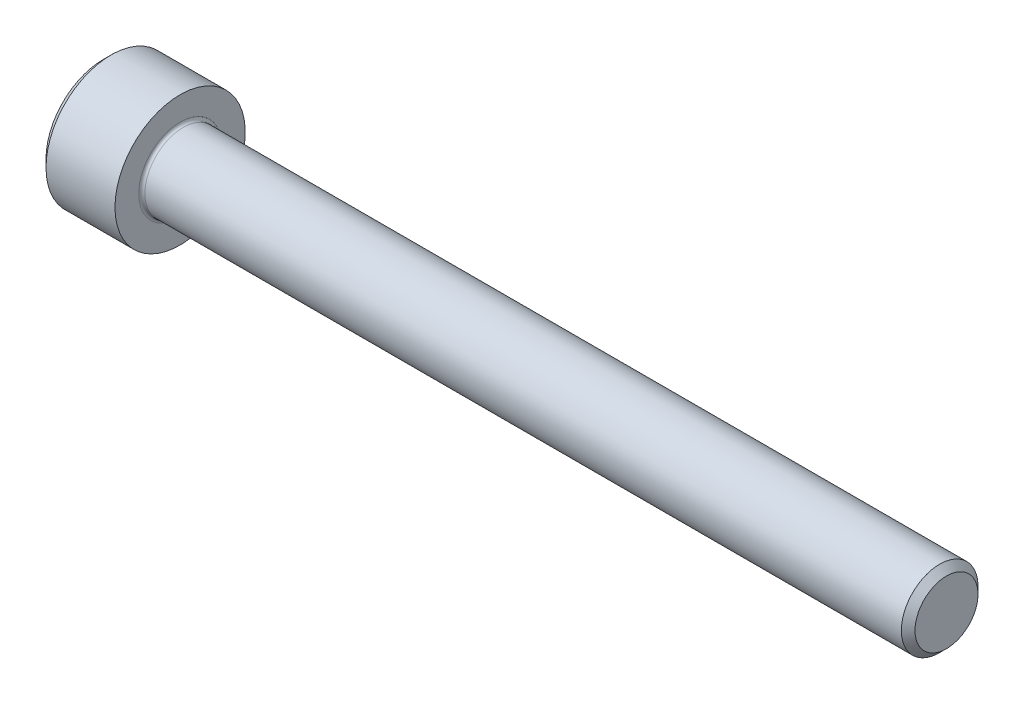
from build123d import *

# Parameters (mm, degrees)
FILLET1_R   = 0.2
HEX_2_DEPTH = 2.5


with BuildPart() as part:
    # BodySke → Base-Revolve (revolve)
    with BuildSketch(Plane.XY, mode=Mode.PRIVATE) as base_revolve_sk:
        Polygon((0, 0), (0, 3.75), (0.5, 4.25), (5, 4.25), (5, 2.5), (54.555, 2.5), (55, 2.055), (55, 0), align=None)
    revolve(base_revolve_sk.sketch.rotate(Axis((-31.75, 0, 0), (1, 0, 0)), 90), axis=Axis((-31.75, 0, 0), (1, 0, 0)))

    # Fillet1
    fillet1_edges = [part.edges().sort_by_distance(p)[0] for p in [
        (5, 0, -2.5),
    ]]
    fillet(fillet1_edges, radius=FILLET1_R)

    # Sketch2 → Hex-PreBroach (revolve, cut)
    with BuildSketch(Plane.XY, mode=Mode.PRIVATE) as hex_prebroach_sk:
        Polygon((0, 2.042), (2.5, 2.042), (3.67894925, 0), (0, 0), align=None)
    revolve(hex_prebroach_sk.sketch.rotate(Axis((0, 0, 0), (1, 0, 0)), 90), axis=Axis((0, 0, 0), (1, 0, 0)), mode=Mode.SUBTRACT)

    # Sketch3 → Hex 2 (cut)
    with BuildSketch(Plane(origin=(0, 0, 0), x_dir=(0, 0.500000000000001, 0.866025403784438), z_dir=(-1, 0, 0))):
        Polygon((1.17894925, 2.042), (-1.17894925, 2.042), (-2.357898499, 0), (-1.17894925, -2.042), (1.17894925, -2.042), (2.357898499, 0), align=None)
    extrude(amount=-HEX_2_DEPTH, mode=Mode.SUBTRACT)


solid = part.part
